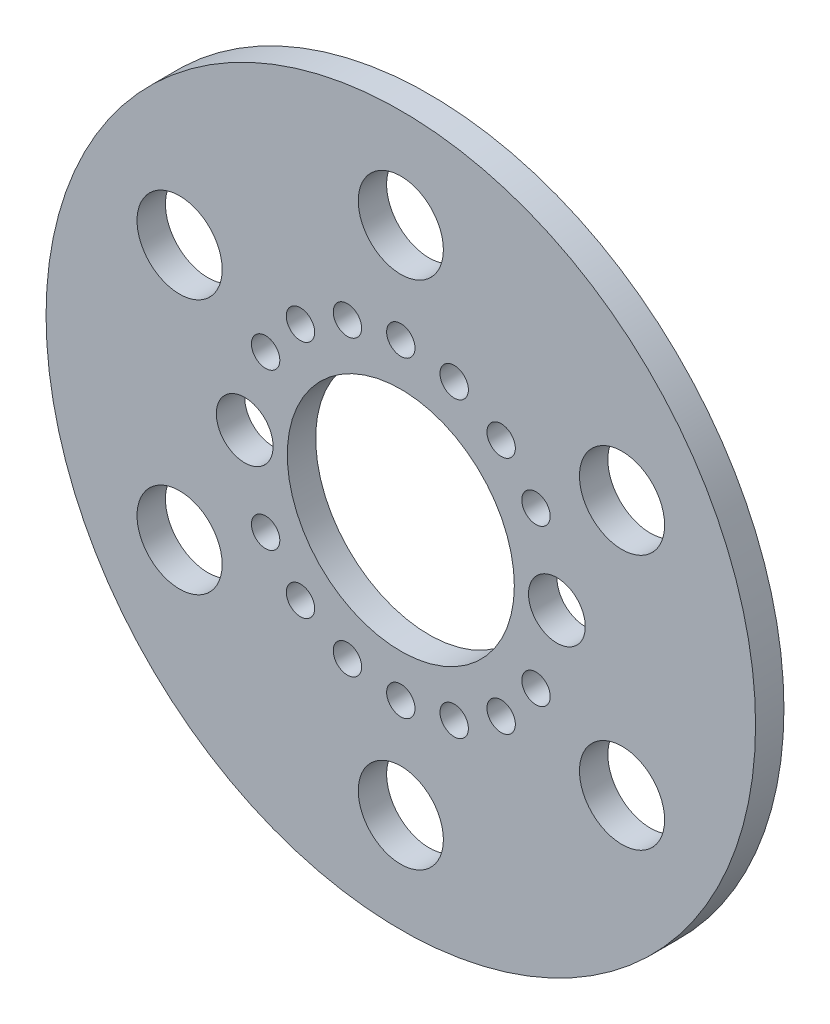
from build123d import *

# Parameters (mm, degrees)
SKETCH_1_R      = 12.5
SKETCH_1_R_2    = 4
SKETCH_1_R_3    = 1.5
SKETCH_1_R_4    = 1
SKETCH_1_R_5    = 0.5
EXTRUDE_1_DEPTH = 1


with BuildPart() as part:
    # Эскиз1 → Бобышка-Вытянуть1 (new body)
    with BuildSketch(Plane.XY):
        Circle(SKETCH_1_R)
        Circle(SKETCH_1_R_2, mode=Mode.SUBTRACT)
        with Locations((0, 9)):
            Circle(SKETCH_1_R_3, mode=Mode.SUBTRACT)
        with Locations((7.794228634, 4.5)):
            Circle(SKETCH_1_R_3, mode=Mode.SUBTRACT)
        with Locations((7.794228634, -4.5)):
            Circle(SKETCH_1_R_3, mode=Mode.SUBTRACT)
        with Locations((0, -9)):
            Circle(SKETCH_1_R_3, mode=Mode.SUBTRACT)
        with Locations((-7.794228634, -4.5)):
            Circle(SKETCH_1_R_3, mode=Mode.SUBTRACT)
        with Locations((-7.794228634, 4.5)):
            Circle(SKETCH_1_R_3, mode=Mode.SUBTRACT)
        with Locations((-5.5, 0)):
            Circle(SKETCH_1_R_4, mode=Mode.SUBTRACT)
        with Locations(Location((5.5, 0, 0), (0, 0, 180))):
            Circle(SKETCH_1_R_4, mode=Mode.SUBTRACT)
        with Locations((0, 5.5)):
            Circle(SKETCH_1_R_5, mode=Mode.SUBTRACT)
        with Locations((1.881110788, 5.168309414)):
            Circle(SKETCH_1_R_5, mode=Mode.SUBTRACT)
        with Locations((3.535331853, 4.213244437)):
            Circle(SKETCH_1_R_5, mode=Mode.SUBTRACT)
        with Locations((4.763139721, 2.75)):
            Circle(SKETCH_1_R_5, mode=Mode.SUBTRACT)
        with Locations((4.763139721, -2.75)):
            Circle(SKETCH_1_R_5, mode=Mode.SUBTRACT)
        with Locations((3.535331853, -4.213244437)):
            Circle(SKETCH_1_R_5, mode=Mode.SUBTRACT)
        with Locations((1.881110788, -5.168309414)):
            Circle(SKETCH_1_R_5, mode=Mode.SUBTRACT)
        with Locations((0, -5.5)):
            Circle(SKETCH_1_R_5, mode=Mode.SUBTRACT)
        with Locations((-1.881110788, -5.168309414)):
            Circle(SKETCH_1_R_5, mode=Mode.SUBTRACT)
        with Locations((-3.535331853, -4.213244437)):
            Circle(SKETCH_1_R_5, mode=Mode.SUBTRACT)
        with Locations((-4.763139721, -2.75)):
            Circle(SKETCH_1_R_5, mode=Mode.SUBTRACT)
        with Locations((-4.763139721, 2.75)):
            Circle(SKETCH_1_R_5, mode=Mode.SUBTRACT)
        with Locations((-3.535331853, 4.213244437)):
            Circle(SKETCH_1_R_5, mode=Mode.SUBTRACT)
        with Locations((-1.881110788, 5.168309414)):
            Circle(SKETCH_1_R_5, mode=Mode.SUBTRACT)
    extrude(amount=EXTRUDE_1_DEPTH)


solid = part.part
